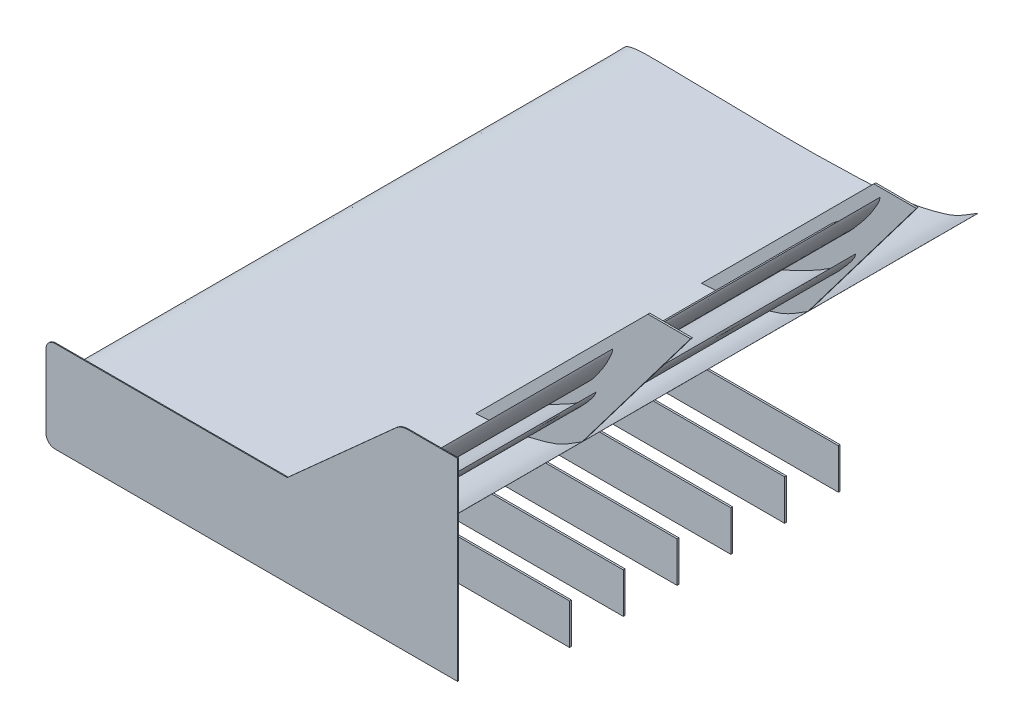
from build123d import *

# Parameters (mm, degrees)
BOSS_EXTRUDE1_DEPTH      = 450
BOSS_EXTRUDE1_DEPTH_BACK = 190
BOSS_EXTRUDE2_DEPTH      = 250
BOSS_EXTRUDE3_DEPTH      = 250
BOSS_EXTRUDE4_DEPTH      = 2
BOSS_EXTRUDE5_DEPTH      = 2
LPATTERN1_COUNT          = 6
LPATTERN1_PITCH          = 60
BOSS_EXTRUDE6_DEPTH      = 190
BOSS_EXTRUDE6_DEPTH_BACK = 9
BOSS_EXTRUDE7_DEPTH      = 190
BOSS_EXTRUDE7_DEPTH_BACK = 8
BOSS_EXTRUDE8_DEPTH      = 1


with BuildPart() as part:
    # Sketch2 → Boss-Extrude1 (new, two sides: drawn at the far end of the back side and taken through both)
    with BuildSketch(Plane.XY.offset(-BOSS_EXTRUDE1_DEPTH_BACK)):
        with BuildLine():
            add(Edge.make_bspline(
                [(331.632547469, -0.155801536), (331.304804648, -0.038615704), (310.948001787, -13.886411779), (288.850742925, -21.453130062), (253.898831549, -29.814375257), (214.402036751, -32.174399069), (174.203238421, -33.535466036), (134.096691432, -34.220910528), (93.868451095, -33.829088664), (53.62355674, -32.933544742), (20.067576666, -32.58062124), (-6.777768577, -32.081964586), (-26.866972083, -31.763971163), (-43.660957345, -31.602077129), (-55.316512, -33.133657225), (-63.217346314, -35.786601004), (-68.168954816, -45.852182452), (-60.935621688, -55.143256382), (-52.810223066, -63.238049464), (-43.602034193, -69.792541019), (-32.757735565, -75.632989434), (-18.848696071, -81.50408464), (-1.571951466, -86.671839376), (25.726118264, -91.610196978), (59.59912915, -93.637086079), (99.829747098, -91.985368399), (139.702918156, -86.499514592), (178.98654912, -76.560782021), (217.989675389, -62.830670059), (256.048180454, -46.795741281), (289.832491564, -28.762312202), (310.639103485, -16.232870327), (331.977351639, -0.279087725), (331.632547469, -0.155801536)],
                knots=[0, 0, 0, 0, 0.026267805, 0.05101645, 0.098803999, 0.146245906, 0.193788091, 0.241403109, 0.289125069, 0.336906896, 0.384666303, 0.408554379, 0.43243685, 0.456234374, 0.468111913, 0.474323291, 0.485191068, 0.501620174, 0.510955397, 0.526909994, 0.541277728, 0.554823463, 0.580548385, 0.605270102, 0.653410558, 0.700937477, 0.748405772, 0.79632416, 0.845052217, 0.894743241, 0.94586851, 0.972364768, 1, 1, 1, 1], degree=3))
        make_face()
    extrude(amount=BOSS_EXTRUDE1_DEPTH + BOSS_EXTRUDE1_DEPTH_BACK)



with BuildPart() as body_2:
    # Sketch2<3> → Boss-Extrude2 (new body)
    with BuildSketch(Plane.XY):
        with BuildLine():
            add(Edge.make_bspline(
                [(385.257108205, 82.500998533), (385.262718652, 82.657045888), (384.403940943, 80.687432876), (383.657706576, 79.56840288), (382.553376289, 77.880744826), (381.233954331, 76.184864639), (379.61594752, 74.258915124), (377.736638316, 72.185446603), (375.60037444, 70.008528092), (373.309357382, 67.729611065), (370.848412879, 65.463576841), (368.293558252, 63.204775791), (365.670442902, 60.975213159), (362.960640755, 58.823348985), (360.203555415, 56.707277406), (357.380855488, 54.655553979), (354.491780752, 52.664392505), (351.549990289, 50.712937144), (348.535317242, 48.824783821), (345.459140164, 46.97521262), (342.311610123, 45.164747337), (339.089536673, 43.392367707), (335.790722934, 41.638176888), (332.415279089, 39.903970969), (328.964217848, 38.171435976), (325.436978114, 36.454789012), (321.858304333, 34.715167763), (318.229022674, 32.983721032), (314.604470592, 31.240931416), (311.029640761, 29.517736405), (307.560681425, 27.861865366), (304.282963455, 26.214837697), (301.21634104, 24.634441536), (298.438022747, 23.094390469), (295.987599383, 21.705919431), (293.95353301, 20.479373817), (292.319432576, 19.464657151), (291.025508113, 18.656269033), (290.006404313, 17.976500048), (289.197724902, 17.387794544), (288.519811704, 16.890485717), (287.960517662, 16.43974363), (287.491120754, 16.025982717), (287.102483552, 15.628801651), (286.801311256, 15.221074048), (286.620429119, 14.776157027), (286.630563726, 14.313890741), (286.79585874, 13.900921156), (287.049630073, 13.538720769), (287.33911776, 13.180813577), (287.701362098, 12.840834513), (288.12857904, 12.511641561), (288.613828785, 12.17448135), (289.174108848, 11.837901495), (289.831514382, 11.525459152), (290.574572898, 11.185189517), (291.448138906, 10.886107434), (292.456337958, 10.57903469), (293.639228133, 10.330006302), (295.008806857, 10.106803979), (296.581131911, 9.935256527), (298.356625654, 9.840500169), (300.302687346, 9.838403517), (302.383471629, 9.965075455), (304.550884742, 10.23286767), (306.770919976, 10.662341838), (309.014855996, 11.254763585), (311.277583013, 12.004951978), (313.554633497, 12.923876771), (315.843408831, 14.040342457), (318.179815559, 15.317754704), (320.56157534, 16.827336468), (323.046696009, 18.540389618), (325.646982127, 20.497688236), (328.400201588, 22.653022964), (331.288852626, 24.971043441), (334.271310095, 27.418603889), (337.317258268, 29.936530581), (340.392398086, 32.478079948), (343.429471804, 35.041894513), (346.434689872, 37.565239214), (349.369794303, 40.070591518), (352.210756975, 42.580941419), (354.983071887, 45.080285535), (357.691572396, 47.589560364), (360.325362768, 50.144615375), (362.915500017, 52.741685683), (365.469865367, 55.378268458), (367.979827785, 58.066762505), (370.450880224, 60.774207375), (372.8462526, 63.48980126), (375.132812849, 66.162720111), (377.240585914, 68.748948508), (379.141540172, 71.160075747), (380.769551114, 73.369334894), (382.123157635, 75.328211383), (383.196109299, 77.0816532), (384.035946379, 78.61947015), (384.607394543, 80.176109737), (384.884574537, 81.247822033), (385.253896678, 82.411674068), (385.257108205, 82.500998533)],
                knots=[0, 0, 0, 0, 0.00687178, 0.013318497, 0.020777589, 0.02943689, 0.039410878, 0.050612524, 0.062849331, 0.075765159, 0.089149388, 0.102734838, 0.116433622, 0.130198357, 0.143995866, 0.157878947, 0.171808007, 0.185837334, 0.19997499, 0.214225182, 0.228640874, 0.243274633, 0.258077981, 0.273195932, 0.288529679, 0.304128025, 0.319976941, 0.335982504, 0.352082187, 0.367938781, 0.383309211, 0.397921185, 0.411683605, 0.424447294, 0.435801067, 0.445269473, 0.452770848, 0.458740355, 0.463463732, 0.467375516, 0.470668278, 0.473489106, 0.475938642, 0.478127703, 0.480104281, 0.481956658, 0.483742746, 0.485466599, 0.487184503, 0.489002786, 0.490948619, 0.493091457, 0.495430759, 0.497992892, 0.500874767, 0.504106146, 0.507732688, 0.511874729, 0.516668635, 0.522133279, 0.528420065, 0.535519847, 0.543327695, 0.551615211, 0.560364178, 0.569353407, 0.578559851, 0.588022127, 0.597764961, 0.607818479, 0.618374991, 0.629504087, 0.641429754, 0.654362395, 0.668309494, 0.683127591, 0.698529964, 0.714320123, 0.730256731, 0.746106292, 0.761718272, 0.777054096, 0.792125015, 0.806928363, 0.821567252, 0.836153821, 0.850685769, 0.865307939, 0.87993042, 0.894546754, 0.909020415, 0.923112208, 0.936492017, 0.948805381, 0.959726546, 0.969206481, 0.977217575, 0.98415149, 0.990330215, 0.996066463, 1, 1, 1, 1], degree=3))
        make_face()
    extrude(amount=BOSS_EXTRUDE2_DEPTH)


with BuildPart() as body_3:
    # Sketch2<4> → Boss-Extrude3 (new body)
    with BuildSketch(Plane.XY):
        with BuildLine():
            add(Edge.make_bspline(
                [(412.154609526, 150.484462569), (412.140228109, 150.587563161), (411.804420618, 149.195019595), (411.444034038, 148.37394516), (410.914371183, 147.138089374), (410.244444203, 145.871935257), (409.405118851, 144.420165959), (408.411316021, 142.841294963), (407.26078849, 141.164758592), (406.020467443, 139.403341197), (404.667091101, 137.630710129), (403.251221795, 135.851956371), (401.787151898, 134.084496527), (400.257173984, 132.358013376), (398.692009287, 130.649555681), (397.076316795, 128.975749124), (395.410035703, 127.33401991), (393.704548111, 125.712256629), (391.943882107, 124.123616288), (390.138369862, 122.553186552), (388.281484535, 121.000171151), (386.371249588, 119.463530895), (384.40852605, 117.929948419), (382.393178336, 116.400615682), (380.327991454, 114.863626089), (378.210951174, 113.328248762), (376.062802091, 111.771833645), (373.880480661, 110.214926771), (371.702577493, 108.651120378), (369.55505052, 107.105934717), (367.469237813, 105.61720598), (365.507958669, 104.156422401), (363.677558258, 102.763822543), (362.031770035, 101.43108645), (360.583709728, 100.235827387), (359.390258446, 99.195078354), (358.434877728, 98.339705419), (357.678949914, 97.659175745), (357.088562796, 97.094904222), (356.625785385, 96.614779255), (356.238280452, 96.209797935), (355.92326274, 95.849121473), (355.662984816, 95.523131558), (355.453809375, 95.217376135), (355.303278937, 94.914821918), (355.23602887, 94.601776861), (355.296197095, 94.299454484), (355.452527247, 94.047459503), (355.661068189, 93.839038956), (355.892561289, 93.637571778), (356.169746474, 93.456297812), (356.488340016, 93.289626927), (356.845956661, 93.124443423), (357.252766413, 92.968326863), (357.720548487, 92.839301284), (358.24778648, 92.701921672), (358.855939571, 92.606691533), (359.553409481, 92.521801073), (360.358851308, 92.495242163), (361.283871589, 92.507251144), (362.336022794, 92.576644557), (363.512672308, 92.719974196), (364.790579456, 92.943884373), (366.142030218, 93.267932311), (367.53401929, 93.694659769), (368.941839626, 94.233629477), (370.346488048, 94.882347431), (371.745209556, 95.63682061), (373.133801126, 96.503733895), (374.507222101, 97.501697714), (375.893282868, 98.610843218), (377.282242452, 99.877667265), (378.715507482, 101.290043731), (380.196107875, 102.876108931), (381.754189157, 104.609896859), (383.382353095, 106.466172544), (385.057108313, 108.418355749), (386.765401642, 110.424087135), (388.490125721, 112.448707099), (390.187280399, 114.483538284), (391.868205628, 116.488111662), (393.505181453, 118.472755601), (395.07977104, 120.449782292), (396.610564819, 122.411636222), (398.098312352, 124.372622544), (399.531710039, 126.355016465), (400.931583852, 128.359941524), (402.303397855, 130.386666888), (403.640050093, 132.442333676), (404.948962582, 134.505937977), (406.20724482, 136.566131284), (407.399028003, 138.585710102), (408.483466274, 140.527675921), (409.452390702, 142.330738615), (410.265486683, 143.969669729), (410.927411259, 145.412448434), (411.428857353, 146.687861232), (411.802216658, 147.794721388), (411.997189294, 148.882869166), (412.055101374, 149.618577418), (412.162841723, 150.425445835), (412.154609526, 150.484462569)],
                knots=[0, 0, 0, 0, 0.00687178, 0.013318497, 0.020777589, 0.02943689, 0.039410878, 0.050612524, 0.062849331, 0.075765159, 0.089149388, 0.102734838, 0.116433622, 0.130198357, 0.143995866, 0.157878947, 0.171808007, 0.185837334, 0.19997499, 0.214225182, 0.228640874, 0.243274633, 0.258077981, 0.273195932, 0.288529679, 0.304128025, 0.319976941, 0.335982504, 0.352082187, 0.367938781, 0.383309211, 0.397921185, 0.411683605, 0.424447294, 0.435801067, 0.445269473, 0.452770848, 0.458740355, 0.463463732, 0.467375516, 0.470668278, 0.473489106, 0.475938642, 0.478127703, 0.480104281, 0.481956658, 0.483742746, 0.485466599, 0.487184503, 0.489002786, 0.490948619, 0.493091457, 0.495430759, 0.497992892, 0.500874767, 0.504106146, 0.507732688, 0.511874729, 0.516668635, 0.522133279, 0.528420065, 0.535519847, 0.543327695, 0.551615211, 0.560364178, 0.569353407, 0.578559851, 0.588022127, 0.597764961, 0.607818479, 0.618374991, 0.629504087, 0.641429754, 0.654362395, 0.668309494, 0.683127591, 0.698529964, 0.714320123, 0.730256731, 0.746106292, 0.761718272, 0.777054096, 0.792125015, 0.806928363, 0.821567252, 0.836153821, 0.850685769, 0.865307939, 0.87993042, 0.894546754, 0.909020415, 0.923112208, 0.936492017, 0.948805381, 0.959726546, 0.969206481, 0.977217575, 0.98415149, 0.990330215, 0.996066463, 1, 1, 1, 1], degree=3))
        make_face()
    extrude(amount=BOSS_EXTRUDE3_DEPTH)


with BuildPart() as part_1:
    add(part.part)

    add(body_2.part)  # Boss-Extrude4 merges body 2

    add(body_3.part)  # Boss-Extrude4 merges body 3
    # Sketch3 → Boss-Extrude4 (add)
    with BuildSketch(Plane.XY):
        with BuildLine():
            Line((213.125966849, -32.061833101), (405.369105002, 160.181305053))
            Line((405.369105002, 160.181305053), (452.864487175, 160.181305053))
            Line((452.864487175, 160.181305053), (331.632547469, -0.155801536))
            add(Edge.make_bspline(
                [(331.632547469, -0.155801536), (331.304804648, -0.038615704), (310.948001787, -13.886411779), (288.850742925, -21.453130062), (253.898831549, -29.814375257), (227.164983916, -31.411783789), (213.51914951, -32.043772488), (213.125966849, -32.061833101)],
                knots=[0, 0, 0, 0, 0.026267805, 0.05101645, 0.098803999, 0.146245906, 0.147653033, 0.147653033, 0.147653033, 0.147653033], degree=3))
        make_face()
    boss_extrude4 = extrude(amount=-BOSS_EXTRUDE4_DEPTH)

    # Mirror1: Boss-Extrude4 across plane
    add(boss_extrude4.mirror(Plane.XY.offset(125)))

    # Sketch4 → Boss-Extrude5 (add)
    with BuildSketch(Plane.XY.offset(65)):
        with BuildLine():
            Line((78.317658396, -92.701211002), (430.835794689, -92.701211002))
            Line((430.835794689, -92.701211002), (430.835794689, -47.701211002))
            Line((430.835794689, -47.701211002), (252.578779402, -47.701211002))
            add(Edge.make_bspline(
                [(78.317658396, -92.701211002), (85.487296777, -92.436977364), (105.968339263, -91.140805042), (139.702918156, -86.499514592), (178.98654912, -76.560782021), (216.835339314, -63.237026295), (240.830238981, -53.203892018), (252.578779402, -47.701211002)],
                knots=[0.675412528, 0.675412528, 0.675412528, 0.675412528, 0.700937477, 0.748405772, 0.79632416, 0.845052217, 0.890412239, 0.890412239, 0.890412239, 0.890412239], degree=3))
        make_face()
    boss_extrude5 = extrude(amount=-BOSS_EXTRUDE5_DEPTH)

    # LPattern1: Boss-Extrude5 ×6
    with Locations(*[(0, 0, i * LPATTERN1_PITCH) for i in range(1, LPATTERN1_COUNT)]):
        add(boss_extrude5)

    # Sketch5 → Boss-Extrude6 (add, two sides: drawn at the far end of the back side and taken through both)
    with BuildSketch(Plane.XY.offset(260).offset(-BOSS_EXTRUDE6_DEPTH_BACK)):
        with BuildLine():
            add(Edge.make_bspline(
                [(347.164711012, 55.730313372), (347.167049563, 55.836056915), (346.603844481, 54.493993819), (346.108899243, 53.729085281), (345.376740644, 52.575690866), (344.498977284, 51.414713224), (343.421136797, 50.095113141), (342.167697527, 48.673151174), (340.741191476, 47.17871602), (339.210826202, 45.613747899), (337.565248281, 44.055913911), (335.855997217, 42.502099473), (334.100239287, 40.967448967), (332.28504066, 39.484611852), (330.437481884, 38.025574277), (328.544879663, 36.609505265), (326.606754557, 35.233833303), (324.632553192, 33.884560631), (322.608395559, 32.577479923), (320.542219867, 31.295954922), (318.427350522, 30.040248159), (316.261636188, 28.809638728), (314.04377525, 27.590629907), (311.773825519, 26.384439222), (309.452644414, 25.178672086), (307.079718761, 23.982952501), (304.672171943, 22.771190725), (302.230271813, 21.564491606), (299.791681257, 20.350154235), (297.386584115, 19.149553963), (295.052562646, 17.995543766), (292.84798629, 16.849314201), (290.785761109, 15.750191154), (288.918426707, 14.68109389), (287.271756235, 13.717732695), (285.905568232, 12.867942975), (284.808293671, 12.165370923), (283.93948827, 11.605731171), (283.255614589, 11.135779003), (282.713408692, 10.729474866), (282.258914913, 10.386298421), (281.884325879, 10.075772555), (281.570277912, 9.79113597), (281.310773287, 9.518485257), (281.110607484, 9.23951049), (280.992262589, 8.936473837), (281.003455968, 8.623475418), (281.119277946, 8.345318797), (281.294549545, 8.102376792), (281.493971652, 7.862677061), (281.742503999, 7.635801444), (282.03494133, 7.416839749), (282.36675894, 7.193025309), (282.74938921, 6.970306617), (283.197576589, 6.764845878), (283.70403741, 6.541339846), (284.298505333, 6.346952402), (284.98423516, 6.148413738), (285.787739832, 5.990824575), (286.717446944, 5.852475797), (287.783990555, 5.751011659), (288.987421321, 5.703460901), (290.305510126, 5.720266035), (291.71364071, 5.82554794), (293.179123458, 6.027222017), (294.67873303, 6.338896227), (296.193004594, 6.7611588), (297.718525803, 7.290452832), (299.252168063, 7.934166307), (300.79190157, 8.711784194), (302.362388567, 9.598857395), (303.961418916, 10.643603937), (305.628550136, 11.827129808), (307.371395606, 13.177161876), (309.215968314, 14.66275621), (311.150745358, 16.259806074), (313.147844412, 17.945471978), (315.187286778, 19.679391598), (317.24627944, 21.42958426), (319.279281384, 23.194500663), (321.291086477, 24.931708461), (323.255572048, 26.656073368), (325.156248526, 28.382941497), (327.010532892, 30.101712502), (328.821502707, 31.826611953), (330.581442547, 33.581818686), (332.311422611, 35.365073596), (334.016804297, 37.17475532), (335.691625683, 39.019180752), (337.339915832, 40.876077192), (338.936871494, 42.73778421), (340.460528274, 44.569568349), (341.86390422, 46.340962601), (343.128841471, 47.991823802), (344.21080452, 49.50340342), (345.109258109, 50.842828816), (345.819547864, 52.040484761), (346.373968285, 53.08991465), (346.746432398, 54.149579619), (346.924129866, 54.878047067), (347.163372381, 55.669783763), (347.164711012, 55.730313372)],
                knots=[0, 0, 0, 0, 0.00687178, 0.013318497, 0.020777589, 0.02943689, 0.039410878, 0.050612524, 0.062849331, 0.075765159, 0.089149388, 0.102734838, 0.116433622, 0.130198357, 0.143995866, 0.157878947, 0.171808007, 0.185837334, 0.19997499, 0.214225182, 0.228640874, 0.243274633, 0.258077981, 0.273195932, 0.288529679, 0.304128025, 0.319976941, 0.335982504, 0.352082187, 0.367938781, 0.383309211, 0.397921185, 0.411683605, 0.424447294, 0.435801067, 0.445269473, 0.452770848, 0.458740355, 0.463463732, 0.467375516, 0.470668278, 0.473489106, 0.475938642, 0.478127703, 0.480104281, 0.481956658, 0.483742746, 0.485466599, 0.487184503, 0.489002786, 0.490948619, 0.493091457, 0.495430759, 0.497992892, 0.500874767, 0.504106146, 0.507732688, 0.511874729, 0.516668635, 0.522133279, 0.528420065, 0.535519847, 0.543327695, 0.551615211, 0.560364178, 0.569353407, 0.578559851, 0.588022127, 0.597764961, 0.607818479, 0.618374991, 0.629504087, 0.641429754, 0.654362395, 0.668309494, 0.683127591, 0.698529964, 0.714320123, 0.730256731, 0.746106292, 0.761718272, 0.777054096, 0.792125015, 0.806928363, 0.821567252, 0.836153821, 0.850685769, 0.865307939, 0.87993042, 0.894546754, 0.909020415, 0.923112208, 0.936492017, 0.948805381, 0.959726546, 0.969206481, 0.977217575, 0.98415149, 0.990330215, 0.996066463, 1, 1, 1, 1], degree=3))
        make_face()
    extrude(amount=BOSS_EXTRUDE6_DEPTH + BOSS_EXTRUDE6_DEPTH_BACK)

    # Sketch5<3> → Boss-Extrude7 (add, two sides: drawn at the far end of the back side and taken through both)
    with BuildSketch(Plane.XY.offset(260).offset(-BOSS_EXTRUDE7_DEPTH_BACK)):
        with BuildLine():
            add(Edge.make_bspline(
                [(365.731967593, 106.692979959), (365.713732888, 106.769153932), (365.563050635, 105.701925323), (365.352588508, 105.060907659), (365.045378653, 104.096992948), (364.635314258, 103.100232402), (364.111820068, 101.952195384), (363.481834669, 100.697784603), (362.741543989, 99.358883114), (361.940149265, 97.949911025), (361.054895863, 96.524355973), (360.123282864, 95.089691239), (359.154753367, 93.659995345), (358.133896847, 92.256216672), (357.085382927, 90.863390436), (355.996518637, 89.492857485), (354.867444768, 88.142685825), (353.70756253, 86.804628872), (352.503957571, 85.487384007), (351.265447549, 84.180530939), (349.987201965, 82.883000802), (348.667815762, 81.593872225), (347.30889791, 80.303233767), (345.910260573, 79.011968306), (344.474851512, 77.711360259), (343.000491166, 76.408205728), (341.504355547, 75.087043225), (339.982662835, 73.763038503), (338.464778588, 72.434186386), (336.968295923, 71.121478997), (335.513945689, 69.855521733), (334.150839267, 68.619509118), (332.880815649, 67.444036383), (331.744719758, 66.326762527), (330.746755497, 65.326763974), (329.928289719, 64.46091519), (329.274701707, 63.751135387), (328.75783207, 63.186740458), (328.356524242, 62.721399163), (328.044695307, 62.328316129), (327.783800116, 61.996959822), (327.573985302, 61.704032508), (327.402655602, 61.44104591), (327.268133195, 61.196913124), (327.177300035, 60.959423458), (327.149597532, 60.720106021), (327.216546133, 60.498043646), (327.3518698, 60.320634668), (327.523141096, 60.179639722), (327.711098558, 60.045513997), (327.931814291, 59.929819481), (328.182484786, 59.828059433), (328.462273172, 59.730238431), (328.778247344, 59.642769301), (329.137924247, 59.580003546), (329.542734265, 59.515285553), (330.005092589, 59.487992463), (330.53359441, 59.474909213), (331.138736687, 59.513328903), (331.830642707, 59.589290198), (332.613606505, 59.717432135), (333.484458161, 59.909960258), (334.425311017, 60.170168172), (335.413993355, 60.51069649), (336.425602503, 60.931059375), (337.440942312, 61.43662996), (338.445961289, 62.024164663), (339.438885207, 62.690473543), (340.416082342, 63.440258825), (341.372430279, 64.287093496), (342.33019547, 65.218110528), (343.278716436, 66.26742761), (344.249881723, 67.428960782), (345.243923581, 68.724001525), (346.285298722, 70.135285525), (347.370293287, 71.643377953), (348.483238177, 73.226671403), (349.617424109, 74.852496702), (350.762548072, 76.493657739), (351.886285237, 78.140470361), (353.000058214, 79.763447063), (354.082358968, 81.368316267), (355.118488254, 82.962964196), (356.122915988, 84.543078165), (357.095167908, 86.119425997), (358.025165785, 87.707871932), (358.92842547, 89.31076513), (359.809092077, 90.927953822), (360.661329752, 92.564272057), (361.492217656, 94.204526698), (362.285433989, 95.838561334), (363.031787496, 97.437364323), (363.703366022, 98.97026931), (364.298488744, 100.390782887), (364.788789278, 101.677092108), (365.180073589, 102.805552764), (365.463287311, 103.797050138), (365.662775468, 104.653040463), (365.730019196, 105.482102116), (365.72012924, 106.03728866), (365.742405484, 106.649376533), (365.731967593, 106.692979959)],
                knots=[0, 0, 0, 0, 0.00687178, 0.013318497, 0.020777589, 0.02943689, 0.039410878, 0.050612524, 0.062849331, 0.075765159, 0.089149388, 0.102734838, 0.116433622, 0.130198357, 0.143995866, 0.157878947, 0.171808007, 0.185837334, 0.19997499, 0.214225182, 0.228640874, 0.243274633, 0.258077981, 0.273195932, 0.288529679, 0.304128025, 0.319976941, 0.335982504, 0.352082187, 0.367938781, 0.383309211, 0.397921185, 0.411683605, 0.424447294, 0.435801067, 0.445269473, 0.452770848, 0.458740355, 0.463463732, 0.467375516, 0.470668278, 0.473489106, 0.475938642, 0.478127703, 0.480104281, 0.481956658, 0.483742746, 0.485466599, 0.487184503, 0.489002786, 0.490948619, 0.493091457, 0.495430759, 0.497992892, 0.500874767, 0.504106146, 0.507732688, 0.511874729, 0.516668635, 0.522133279, 0.528420065, 0.535519847, 0.543327695, 0.551615211, 0.560364178, 0.569353407, 0.578559851, 0.588022127, 0.597764961, 0.607818479, 0.618374991, 0.629504087, 0.641429754, 0.654362395, 0.668309494, 0.683127591, 0.698529964, 0.714320123, 0.730256731, 0.746106292, 0.761718272, 0.777054096, 0.792125015, 0.806928363, 0.821567252, 0.836153821, 0.850685769, 0.865307939, 0.87993042, 0.894546754, 0.909020415, 0.923112208, 0.936492017, 0.948805381, 0.959726546, 0.969206481, 0.977217575, 0.98415149, 0.990330215, 0.996066463, 1, 1, 1, 1], degree=3))
        make_face()
    extrude(amount=BOSS_EXTRUDE7_DEPTH + BOSS_EXTRUDE7_DEPTH_BACK)

    # Sketch7 → Boss-Extrude8 (add)
    with BuildSketch(Plane.XY.offset(450)):
        with BuildLine():
            Line((0, 0), (-57.38894796, 0))
            ThreePointArc((-57.38894796, 0), (-64.460015772, -2.928932188), (-67.38894796, -10))
            Line((-67.38894796, -10), (-67.38894796, -92))
            ThreePointArc((-67.38894796, -92), (-64.460015772, -99.071067812), (-57.38894796, -102))
            Line((-57.38894796, -102), (391.860075934, -102))
            Line((391.860075934, -102), (391.860075934, 113.61454962))
            Line((391.860075934, 113.61454962), (336.19583481, 113.61454962))
            ThreePointArc((336.19583481, 113.61454962), (329.046808312, 112.293185013), (322.842428873, 108.503691633))
            Line((322.842428873, 108.503691633), (201.860045719, 0))
            Line((201.860045719, 0), (0, 0))
        make_face()
    extrude(amount=BOSS_EXTRUDE8_DEPTH)


solid = part_1.part
